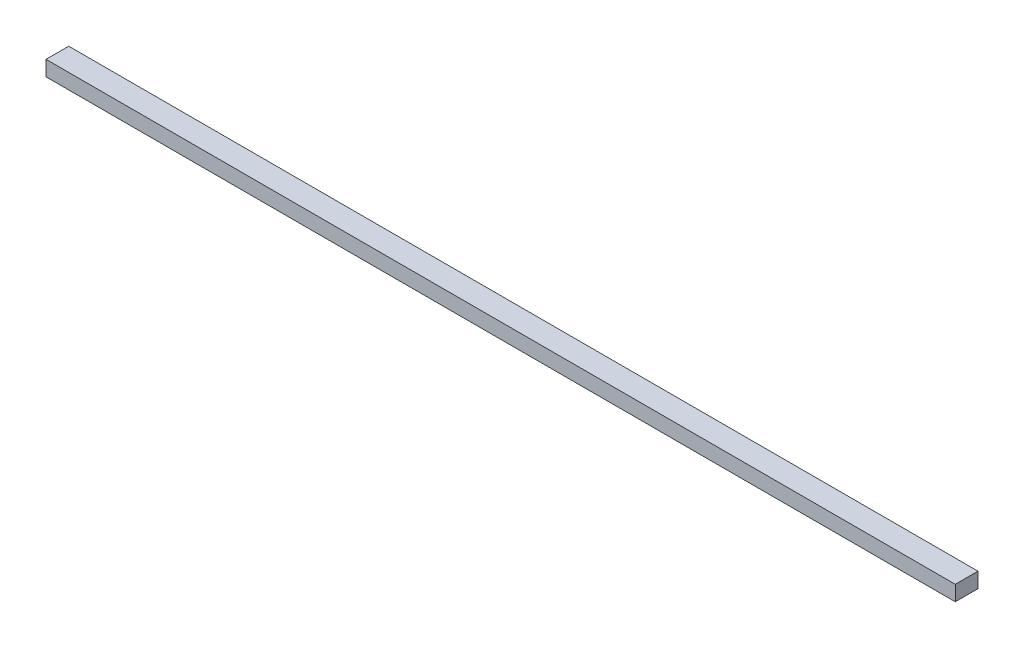
from build123d import *

# Parameters (mm, degrees)
SKETCH1_W           = 600
SKETCH1_H           = 15
BOSS_EXTRUDE1_DEPTH = 10


with BuildPart() as part:
    # Sketch1 → Boss-Extrude1 (new body)
    with BuildSketch(Plane(origin=(0, 0, 0), x_dir=(1, 0, 0), z_dir=(0, 1, 0))):
        with Locations((300, -7.5)):
            Rectangle(SKETCH1_W, SKETCH1_H)
    extrude(amount=BOSS_EXTRUDE1_DEPTH)


solid = part.part
